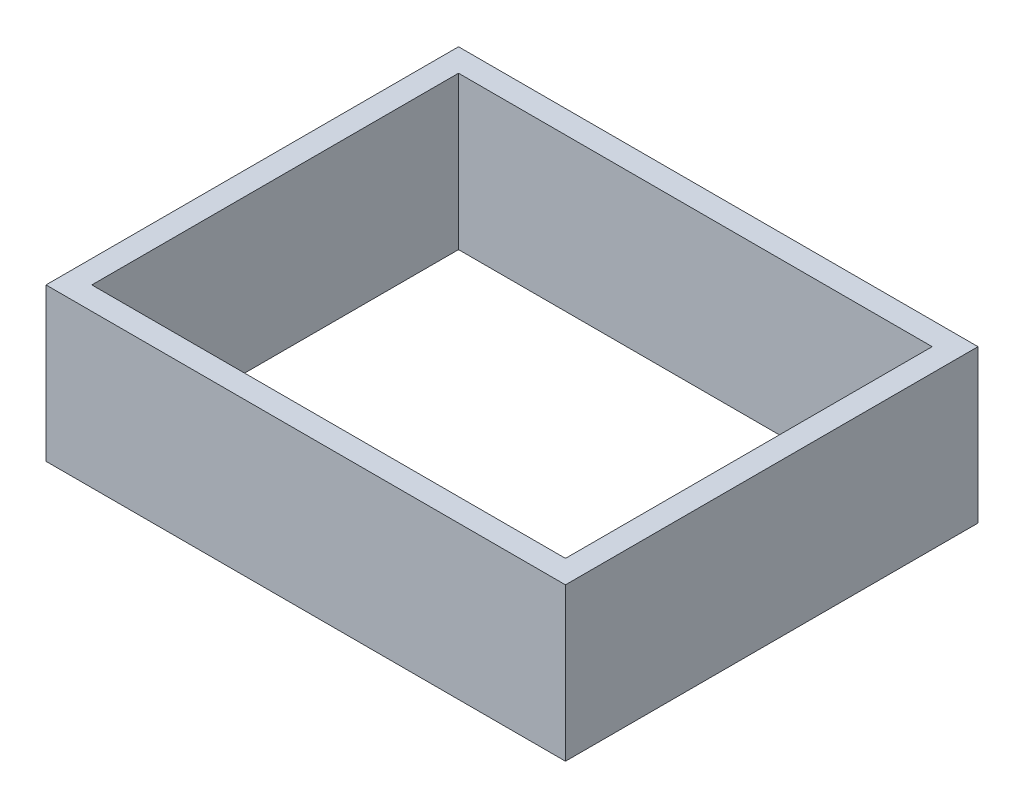
from build123d import *

# Parameters (mm, degrees)
SKETCH1_W           = 68
SKETCH1_H           = 54
SKETCH1_W_2         = 62
SKETCH1_H_2         = 48
BOSS_EXTRUDE1_DEPTH = 20


with BuildPart() as part:
    # Sketch1 → Boss-Extrude1 (new body)
    with BuildSketch(Plane(origin=(0, 0, 0), x_dir=(1, 0, 0), z_dir=(0, 1, 0))):
        Rectangle(SKETCH1_W, SKETCH1_H)
        Rectangle(SKETCH1_W_2, SKETCH1_H_2, mode=Mode.SUBTRACT)
    extrude(amount=BOSS_EXTRUDE1_DEPTH)


solid = part.part
